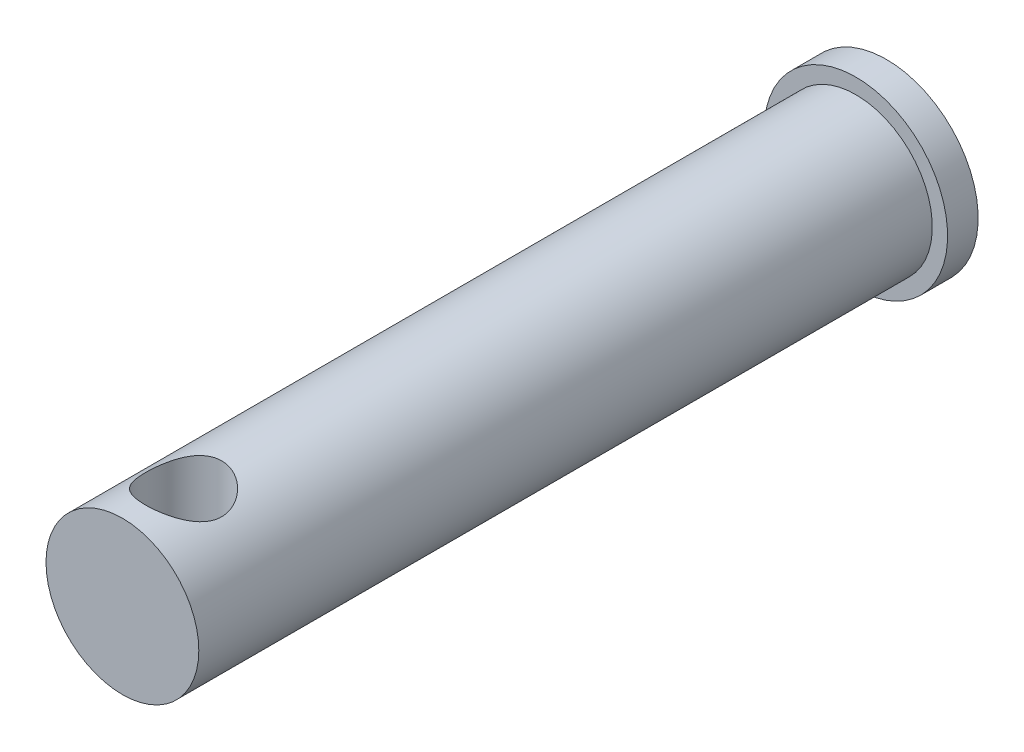
from build123d import *

# Parameters (mm, degrees)
SKETCH3_R           = 0.635
BOSS_EXTRUDE1_DEPTH = 3.175
SKETCH4_R           = 0.3175
CUT_EXTRUDE1_DEPTH  = 1.524
BOSS_EXTRUDE2_START = -0.254
SKETCH5_R           = 0.762
SKETCH5_R_2         = 0.635
BOSS_EXTRUDE2_DEPTH = 0.254


with BuildPart() as part:
    # Sketch3 → Boss-Extrude1 (new, symmetric)
    with BuildSketch(Plane.XY):
        Circle(SKETCH3_R)
    extrude(amount=BOSS_EXTRUDE1_DEPTH, both=True)

    # Sketch4 → Cut-Extrude1 (cut, symmetric)
    with BuildSketch(Plane(origin=(0, 0, 0), x_dir=(1, 0, 0), z_dir=(0, 1, 0))):
        with Locations(Location((0, -2.667, 0), (0, 0, 270))):
            Circle(SKETCH4_R)
    extrude(amount=CUT_EXTRUDE1_DEPTH, both=True, mode=Mode.SUBTRACT)

    # Sketch5 → Boss-Extrude2 (add)
    with BuildSketch(Plane(origin=(0, 0, -3.175), x_dir=(-1, 0, 0), z_dir=(0, 0, -1)).offset(BOSS_EXTRUDE2_START)):
        Circle(SKETCH5_R)
        Circle(SKETCH5_R_2, mode=Mode.SUBTRACT)
    extrude(amount=BOSS_EXTRUDE2_DEPTH)


solid = part.part
